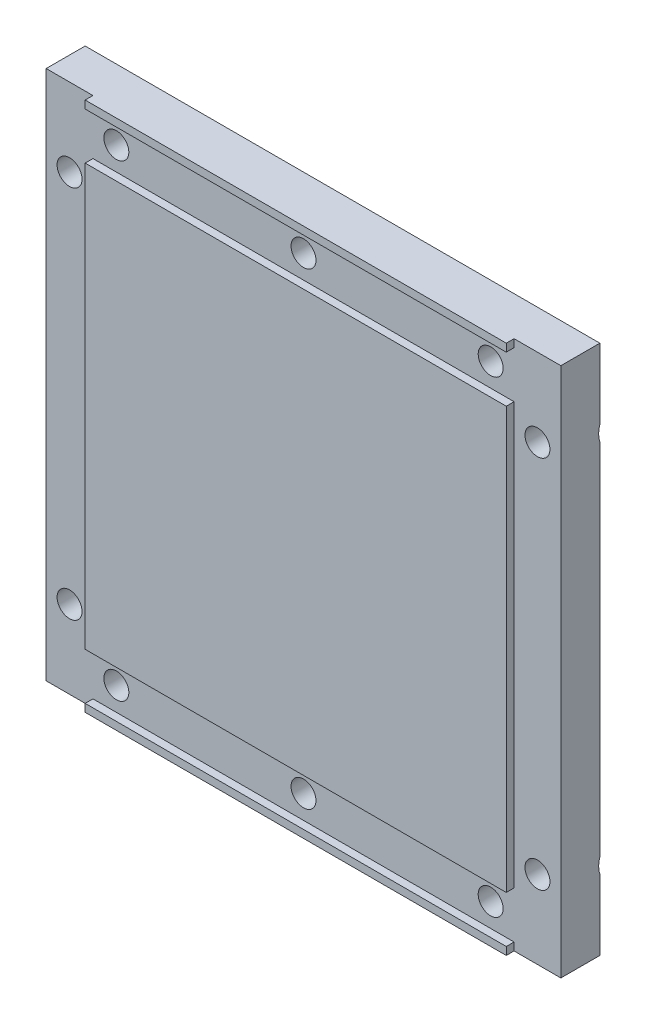
from build123d import *

# Parameters (mm, degrees)
SKETCH_1_W                   = 66
SKETCH_1_H                   = 68
EXTRUDE_1_DEPTH              = 3
CUT_EXTRUDE_START            = 3
SKETCH_1_3_W                 = 54
SKETCH_1_3_H                 = 54
CUT_EXTRUDE_1_DEPTH          = 1
HOLE_WIZARD_M3_1_D           = 3.2
HOLE_WIZARD_M3_1_CSINK_D     = 6.3
HOLE_WIZARD_M3_1_CSINK_ANGLE = 90
M3X0_5_1_D                   = 2.5
M3X0_5_1_DEPTH               = 8.5
M3X0_5_1_CBORE_D             = 3
M3X0_5_1_CBORE_DEPTH         = 6
M3X0_5_1_TIP                 = 0.751075774


with BuildPart() as part:
    # ｽｹｯﾁ1 → ﾎﾞｽ - 押し出し1 (new, symmetric)
    with BuildSketch(Plane.XY):
        Rectangle(SKETCH_1_W, SKETCH_1_H)
    extrude(amount=EXTRUDE_1_DEPTH, both=True)

    # ｽｹｯﾁ1<3> → ｶｯﾄ - 押し出し1 (cut)
    with BuildSketch(Plane.XY.offset(CUT_EXTRUDE_START)):
        Polygon((-27, 34), (-33, 34), (-33, -34), (-27, -34), (-27, -33), (27, -33), (27, -34), (33, -34), (33, 34), (27, 34), (27, 33), (-27, 33), align=None)
        Rectangle(SKETCH_1_3_W, SKETCH_1_3_H, mode=Mode.SUBTRACT)
    extrude(amount=-CUT_EXTRUDE_1_DEPTH, mode=Mode.SUBTRACT)

    # M3 丸皿ねじ用皿穴1 (through all)
    with Locations(Plane(origin=(24, 30, -3), x_dir=(-1, 0, 0), z_dir=(0, 0, -1))):
        with Locations((0, 0), (24, 0), (48, 0), (48, -60), (24, -60), (0, -60), (-6, -6), (-6, -54), (54, -54), (54, -6)):
            CounterSinkHole(HOLE_WIZARD_M3_1_D / 2, HOLE_WIZARD_M3_1_CSINK_D / 2, counter_sink_angle=HOLE_WIZARD_M3_1_CSINK_ANGLE)

    # M3x0.5 ねじ穴1
    with Locations(Plane(origin=(-15, -34, 0), x_dir=(-1, 0, 0), z_dir=(0, -1, 0))):
        with Locations((0, 0), (-30, 0)):
            CounterBoreHole(M3X0_5_1_D / 2, M3X0_5_1_CBORE_D / 2, M3X0_5_1_CBORE_DEPTH, depth=M3X0_5_1_DEPTH)
            with Locations((0, 0, -(M3X0_5_1_DEPTH + M3X0_5_1_TIP / 2))):  # 118° drill point
                Cone(0, M3X0_5_1_D / 2, M3X0_5_1_TIP, mode=Mode.SUBTRACT)


solid = part.part
